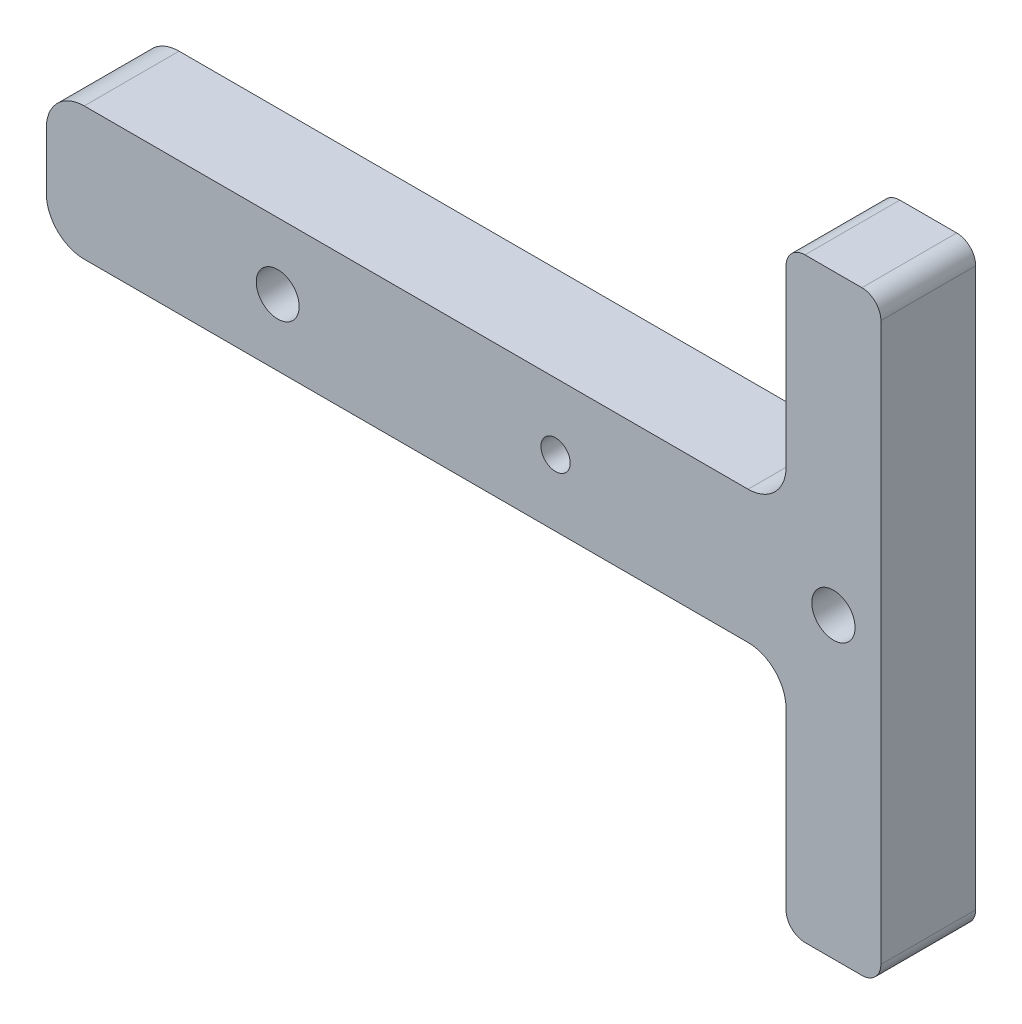
from build123d import *

# Parameters (mm, degrees)
BOSS_EXTRUDE1_DEPTH = 5
SKETCH2_R           = 1.140983763
SKETCH2_R_2         = 1.130194527
CUT_EXTRUDE1_DEPTH  = 32.526020999
SKETCH3_R           = 0.77
CUT_EXTRUDE2_DEPTH  = 3


with BuildPart() as part:
    # Sketch1 → Boss-Extrude1 (new body)
    with BuildSketch(Plane.XY):
        with BuildLine():
            Line((-17.5, 0), (17.5, 0))
            ThreePointArc((17.5, 0), (18.914213562, 0.585786438), (19.5, 2))
            Line((19.5, 2), (19.5, 11.2))
            ThreePointArc((19.5, 11.2), (19.792893219, 11.907106781), (20.5, 12.2))
            Line((20.5, 12.2), (23.5, 12.2))
            ThreePointArc((23.5, 12.2), (24.207106781, 11.907106781), (24.5, 11.2))
            Line((24.5, 11.2), (24.5, -18.2))
            ThreePointArc((24.5, -18.2), (24.207106781, -18.907106781), (23.5, -19.2))
            Line((23.5, -19.2), (20.5, -19.2))
            ThreePointArc((20.5, -19.2), (19.792893219, -18.907106781), (19.5, -18.2))
            Line((19.5, -18.2), (19.5, -9))
            ThreePointArc((19.5, -9), (18.914213562, -7.585786438), (17.5, -7))
            Line((17.5, -7), (-17.5, -7))
            ThreePointArc((-17.5, -7), (-18.914213562, -6.414213562), (-19.5, -5))
            Line((-19.5, -5), (-19.5, -2))
            ThreePointArc((-19.5, -2), (-18.914213562, -0.585786438), (-17.5, 0))
        make_face()
    extrude(amount=BOSS_EXTRUDE1_DEPTH)

    # Sketch2 → Cut-Extrude1 (cut, through all)
    with BuildSketch(Plane.XY.offset(5)):
        with Locations((22, -3.5)):
            Circle(SKETCH2_R)
        with Locations((-7.3, -3.5)):
            Circle(SKETCH2_R_2)
    extrude(amount=-CUT_EXTRUDE1_DEPTH, mode=Mode.SUBTRACT)

    # Sketch3 → Cut-Extrude2 (cut)
    with BuildSketch(Plane.XY.offset(5)):
        with Locations((7.35, -3.5)):
            Circle(SKETCH3_R)
    extrude(amount=-CUT_EXTRUDE2_DEPTH, mode=Mode.SUBTRACT)


solid = part.part
